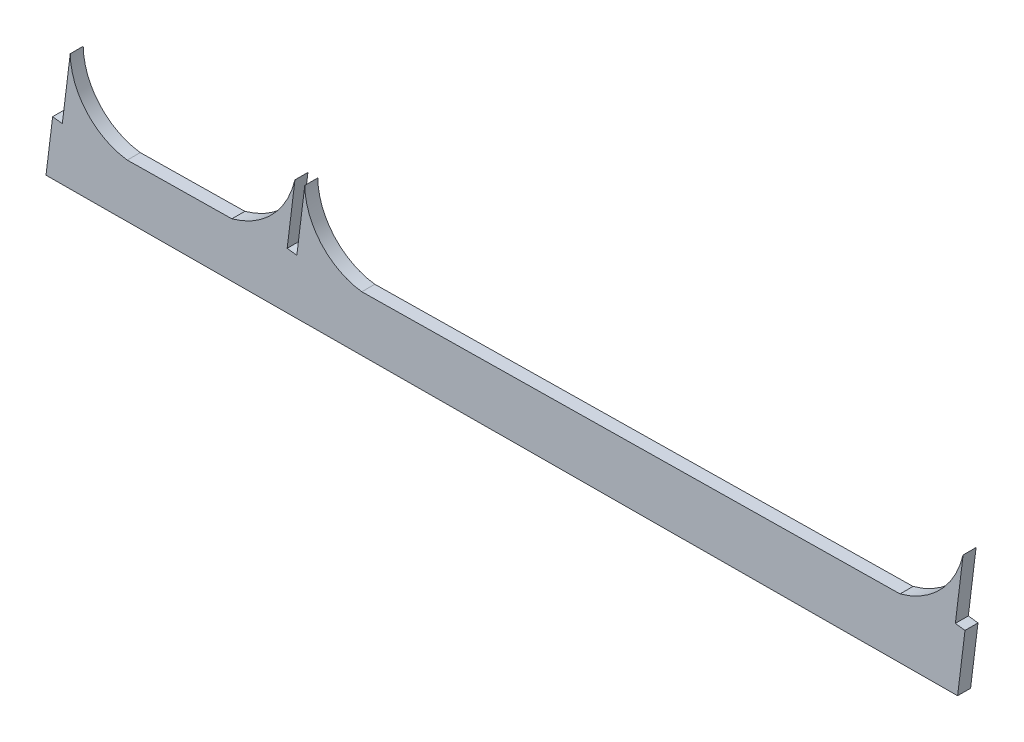
from build123d import *

# Parameters (mm, degrees)
EXTRUDE_1_DEPTH = 2


with BuildPart() as part:
    # Model → 凸台-拉伸1 (new body)
    with BuildSketch(Plane.XY):
        with BuildLine():
            Line((13.756138035, 8.504570041), (154.085282898, 9.270484114))
            Line((154.085282898, 9.270484114), (155.225675402, 18.558235729))
            Line((155.225675402, 18.558235729), (153.736856174, 18.741039745))
            Line((153.736856174, 18.741039745), (154.930535969, 28.462781514))
            ThreePointArc((154.930535969, 28.462781514), (151.455462166, 22.111002891), (145.226629731, 18.420084836))
            Line((145.226629731, 18.420084836), (62.369712658, 17.275299877))
            ThreePointArc((62.369712658, 17.275299877), (56.144799442, 20.522983318), (53.589360421, 27.062610501))
            Line((53.589360421, 27.062610501), (52.370666987, 17.137148984))
            Line((52.370666987, 17.137148984), (50.881847759, 17.319952999))
            Line((50.881847759, 17.319952999), (52.075527554, 27.041694768))
            ThreePointArc((52.075527554, 27.041694768), (48.600453751, 20.689916146), (42.371621316, 16.998998091))
            Line((42.371621316, 16.998998091), (26.265146572, 16.776464467))
            ThreePointArc((26.265146572, 16.776464467), (20.040233356, 20.024147907), (17.484794335, 26.56377509))
            Line((17.484794335, 26.56377509), (16.266100901, 16.638313574))
            Line((16.266100901, 16.638313574), (14.777281674, 16.821117589))
            Line((14.777281674, 16.821117589), (13.756138035, 8.504570041))
        make_face()
    extrude(amount=EXTRUDE_1_DEPTH)


solid = part.part
